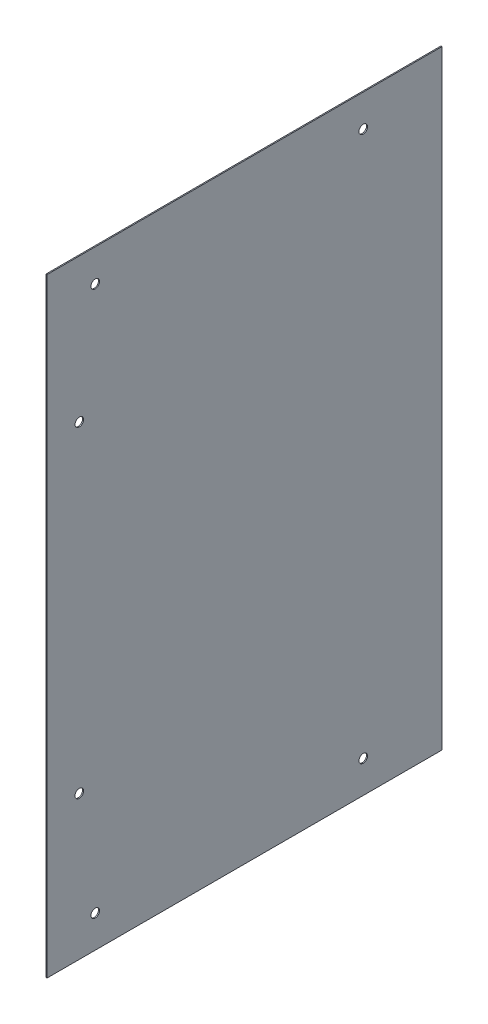
from build123d import *

# Parameters (mm, degrees)
SKETCH1_W               = 568.25
SKETCH1_H               = 368.25
BOSS_EXTRUDE1_DEPTH     = 0.5
CUT_EXTRUDE1_DEPTH      = 339.570570561
CUT_EXTRUDE1_DEPTH_BACK = 339.570570561
SKETCH2_R               = 4


with BuildPart() as part:
    # Sketch1 → Boss-Extrude1 (new, symmetric)
    with BuildSketch(Plane.YZ):
        Rectangle(SKETCH1_W, SKETCH1_H)
    extrude(amount=BOSS_EXTRUDE1_DEPTH, both=True)

    # Sketch2 → Cut-Extrude1 (cut, two sides: drawn at the far end of the back side and taken through both)
    with BuildSketch(Plane(origin=(0.5, 0, 0), x_dir=(0, 0, -1), z_dir=(1, 0, 0)).offset(-CUT_EXTRUDE1_DEPTH_BACK)):
        with Locations((-154.125, 150)):
            Circle(SKETCH2_R)
        with Locations((-154.125, -150)):
            Circle(SKETCH2_R)
        with Locations((-139.261087025, -254.125)):
            Circle(SKETCH2_R)
        with Locations((110.738912975, -254.125)):
            Circle(SKETCH2_R)
        with Locations(Location((110.738912975, 254.125, 0), (0, 0, 180))):
            Circle(SKETCH2_R)
        with Locations(Location((-139.261087025, 254.125, 0), (0, 0, 180))):
            Circle(SKETCH2_R)
    extrude(amount=CUT_EXTRUDE1_DEPTH + CUT_EXTRUDE1_DEPTH_BACK, mode=Mode.SUBTRACT)


solid = part.part
